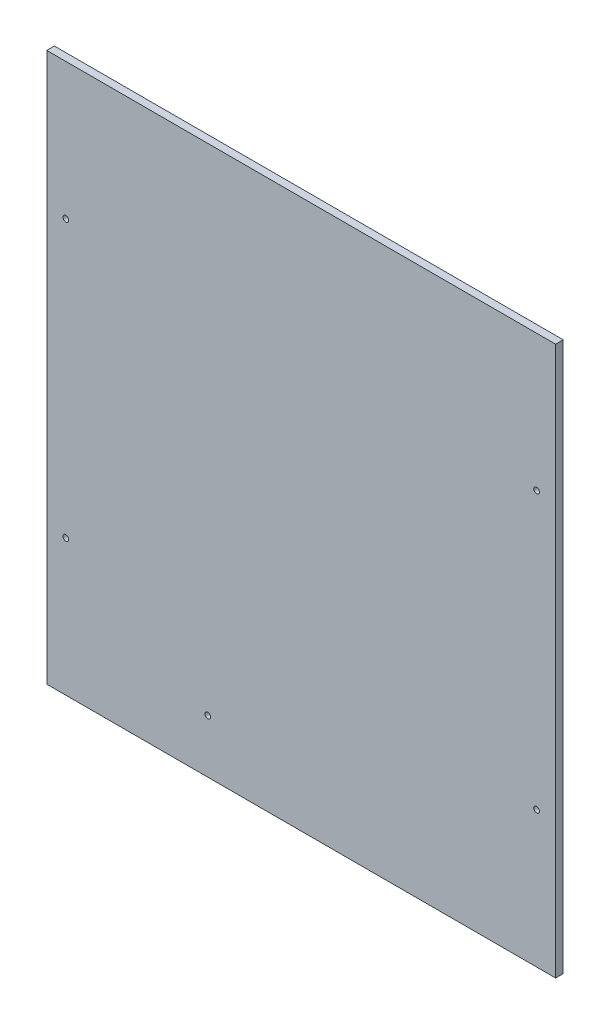
from build123d import *

# Parameters (mm, degrees)
ESQUISSE1_W      = 267
ESQUISSE1_H      = 288
ESQUISSE1_R      = 1.5
EXTRUSION1_DEPTH = 4


with BuildPart() as part:
    # Esquisse1 → Extrusion1 (new body)
    with BuildSketch(Plane.XY):
        with Locations((123.5, 109.644166131)):
            Rectangle(ESQUISSE1_W, ESQUISSE1_H)
        with Locations((0, 182.144166131)):
            Circle(ESQUISSE1_R, mode=Mode.SUBTRACT)
        with Locations((0, 37.144166131)):
            Circle(ESQUISSE1_R, mode=Mode.SUBTRACT)
        with Locations((247, 37.144166131)):
            Circle(ESQUISSE1_R, mode=Mode.SUBTRACT)
        with Locations((247, 182.144166131)):
            Circle(ESQUISSE1_R, mode=Mode.SUBTRACT)
        with Locations((74.5, -6.355833869)):
            Circle(ESQUISSE1_R, mode=Mode.SUBTRACT)
    extrude(amount=EXTRUSION1_DEPTH)


solid = part.part
